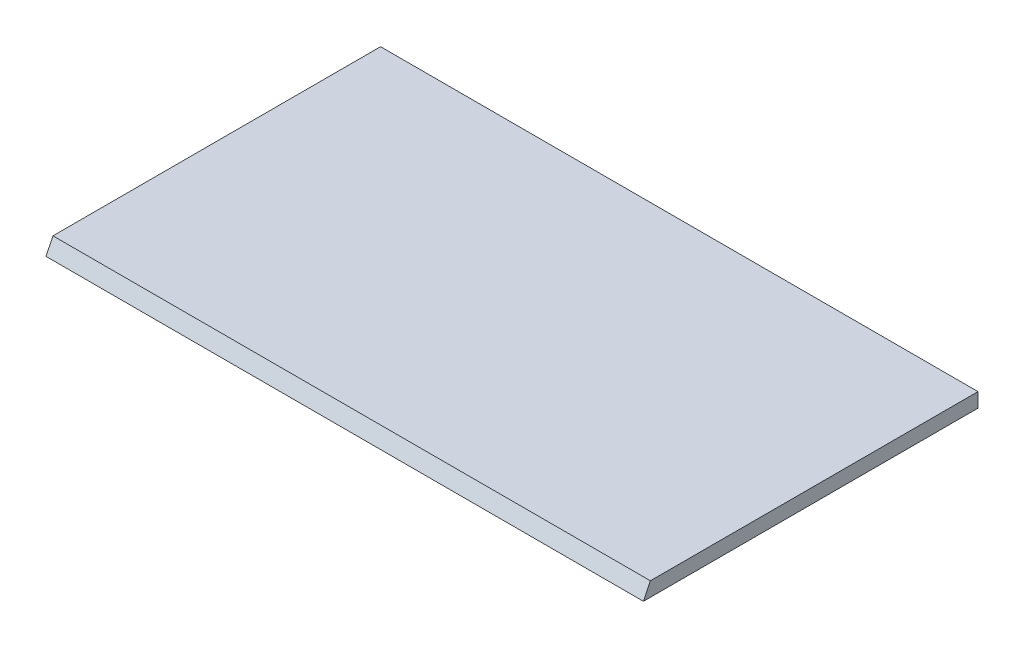
from build123d import *

# Parameters (mm, degrees)
ESBO_O1_W                = 250
ESBO_O1_H                = 6
RESSALTO_EXTRUS_O1_DEPTH = 140
CORTE_EXTRUS_O2_DEPTH    = 287.593789186


with BuildPart() as part:
    # Esboço1 → Ressalto-extrusão1 (new body)
    with BuildSketch(Plane.XY):
        with Locations((125, -3)):
            Rectangle(ESBO_O1_W, ESBO_O1_H)
    extrude(amount=RESSALTO_EXTRUS_O1_DEPTH)

    # Esboço5 → Corte-extrusão2 (cut, through all)
    with BuildSketch(Plane.ZY):
        Polygon((137.1, 0), (140, -6), (140, 0), align=None)
    extrude(amount=-CORTE_EXTRUS_O2_DEPTH, mode=Mode.SUBTRACT)


solid = part.part
